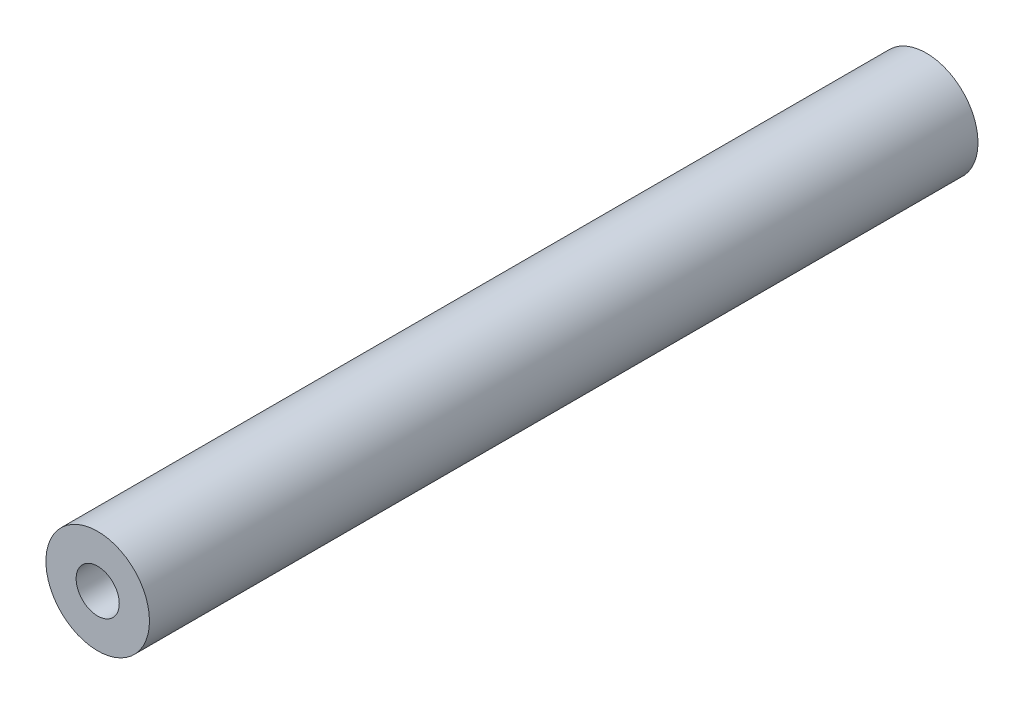
from build123d import *

# Parameters (mm, degrees)
SKETCH1_R                 = 3
BOSS_EXTRUDE1_DEPTH       = 24
M3X0_5_TAPPED_HOLE1_D     = 2.5
M3X0_5_TAPPED_HOLE1_DEPTH = 24


with BuildPart() as part:
    # Sketch1 → Boss-Extrude1 (new, symmetric)
    with BuildSketch(Plane.XY):
        Circle(SKETCH1_R)
    extrude(amount=BOSS_EXTRUDE1_DEPTH, both=True)

    # M3x0.5 Tapped Hole1
    with Locations(Plane.XY.offset(24)):
        with Locations((0, 0)):
            m3x0_5_tapped_hole1 = Hole(M3X0_5_TAPPED_HOLE1_D / 2, depth=M3X0_5_TAPPED_HOLE1_DEPTH)

    # Mirror1: M3x0.5 Tapped Hole1 across plane
    add(m3x0_5_tapped_hole1.mirror(Plane.XY), mode=Mode.SUBTRACT)


solid = part.part
